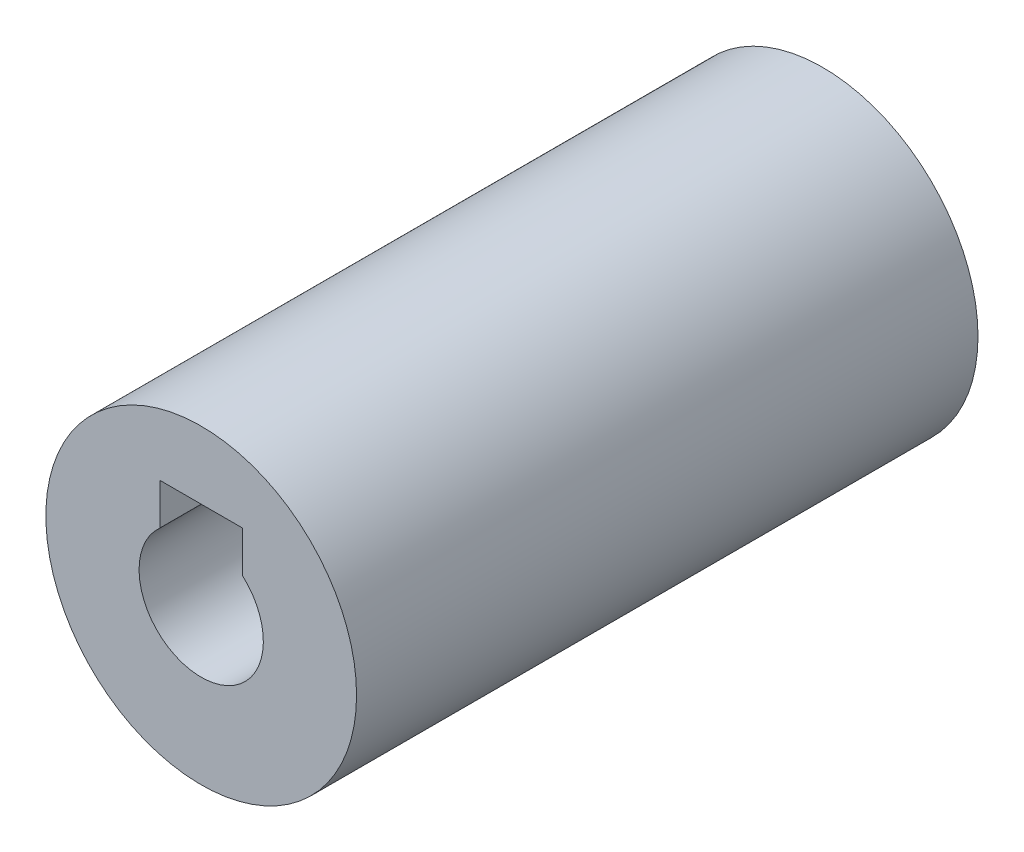
from build123d import *

# Parameters (mm, degrees)
SKETCH1_R           = 7.5
SKETCH1_R_2         = 3
BOSS_EXTRUDE1_DEPTH = 30
CUT_EXTRUDE1_DEPTH  = 32.819805153


with BuildPart() as part:
    # Sketch1 → Boss-Extrude1 (new body)
    with BuildSketch(Plane.XY):
        Circle(SKETCH1_R)
        Circle(SKETCH1_R_2, mode=Mode.SUBTRACT)
    extrude(amount=BOSS_EXTRUDE1_DEPTH)

    # Sketch2 → Cut-Extrude1 (cut, through all)
    with BuildSketch(Plane.XY.offset(30)):
        with BuildLine():
            ThreePointArc((-2, 2.236067977), (-1.070466269, 2.802517077), (0, 3))
            Line((0, 3), (0, 4.236067977))
            Line((0, 4.236067977), (-2, 4.236067977))
            Line((-2, 4.236067977), (-2, 2.236067977))
        make_face()
        with BuildLine():
            Line((0, 4.236067977), (0, 3))
            ThreePointArc((0, 3), (1.070466269, 2.802517077), (2, 2.236067977))
            Line((2, 2.236067977), (2, 4.236067977))
            Line((2, 4.236067977), (0, 4.236067977))
        make_face()
    extrude(amount=-CUT_EXTRUDE1_DEPTH, mode=Mode.SUBTRACT)


solid = part.part
